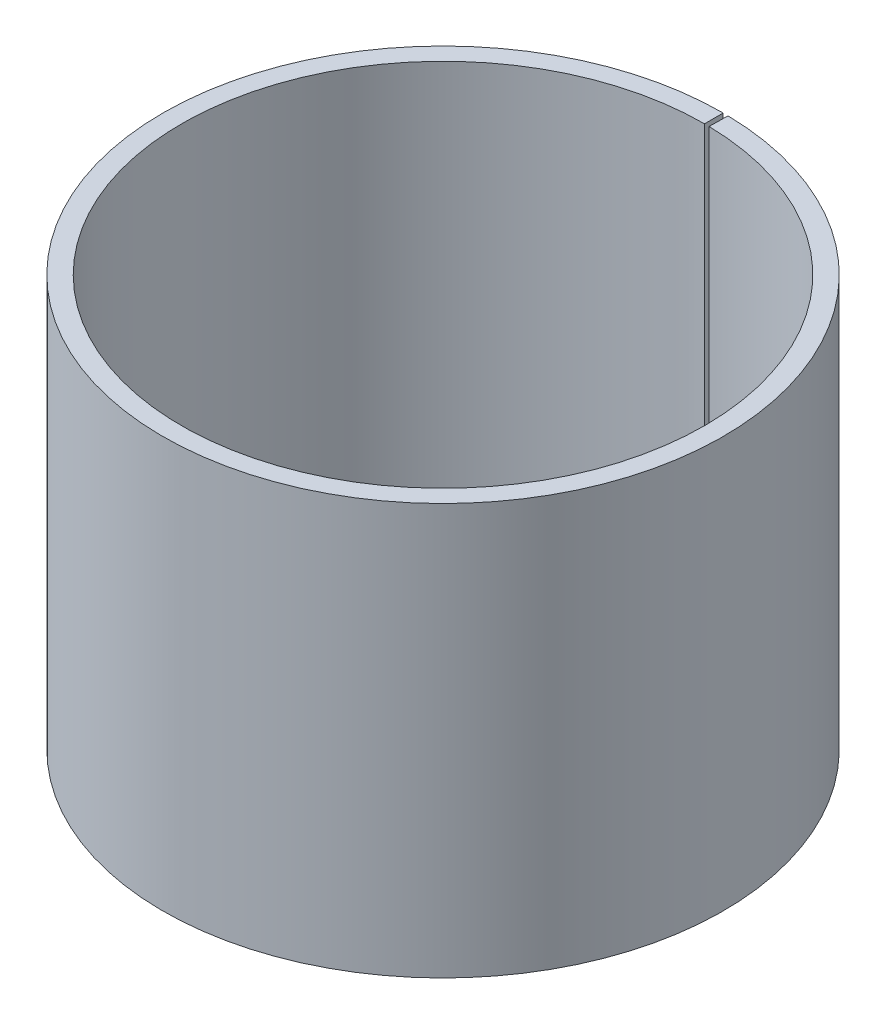
from build123d import *

# Parameters (mm, degrees)
SKETCH3_W           = 7.62
SKETCH3_H           = 167.64
REVOLVE_THIN3_ANGLE = 359


with BuildPart() as part:
    # Sketch3 → Revolve-Thin3 (revolve)
    with BuildSketch(Plane(origin=(0, 0, 0), x_dir=(0, 0, -1), z_dir=(1, 0, 0))):
        with Locations((110.49, 83.82)):
            Rectangle(SKETCH3_W, SKETCH3_H)
    revolve(axis=Axis((0, 0, 0), (0, 1, 0)), revolution_arc=REVOLVE_THIN3_ANGLE)


solid = part.part
